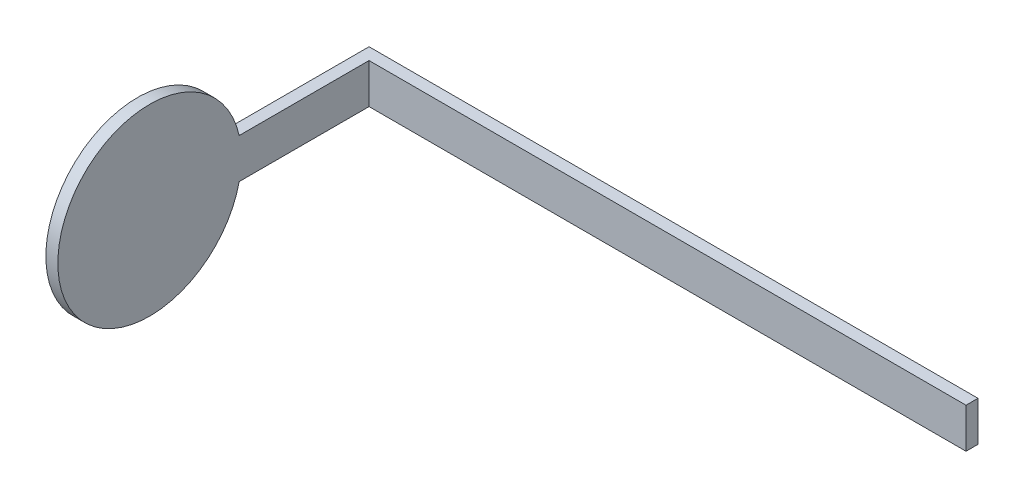
from build123d import *

# Parameters (mm, degrees)
EXTRUDE_2_DEPTH = 10
SKETCH_2_R      = 23
EXTRUDE_3_DEPTH = 3


with BuildPart() as part:
    # Эскиз1 → Выдавливание2 (new body)
    with BuildSketch(Plane(origin=(0, 0, 0), x_dir=(-1, 0, 0), z_dir=(0, 1, 0))):
        Polygon((0, 0), (0, -3), (152.615, -3), (152.615, 60), (149.615, 60), (149.615, 0), align=None)
    extrude(amount=EXTRUDE_2_DEPTH)

    # Эскиз2 → Выдавливание3 (add)
    with BuildSketch(Plane(origin=(-149.615, 0, 0), x_dir=(0, 0, -1), z_dir=(1, 0, 0))):
        with Locations((-55, 5)):
            Circle(SKETCH_2_R)
    extrude(amount=-EXTRUDE_3_DEPTH)


solid = part.part
